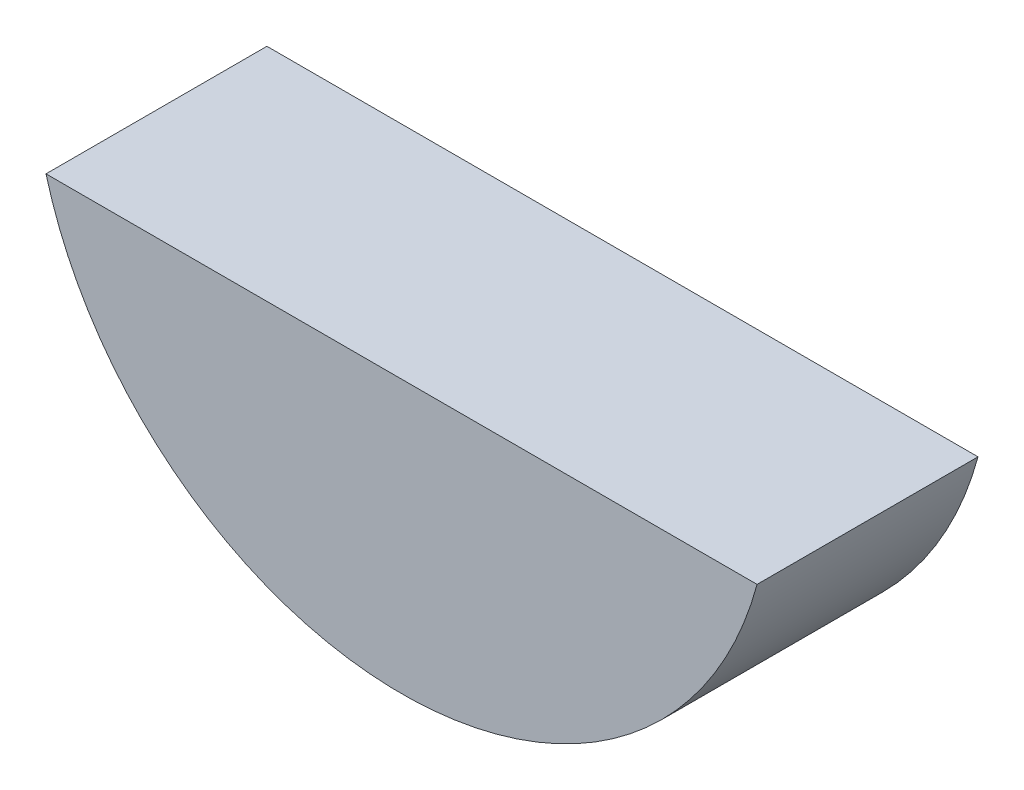
from build123d import *

# Parameters (mm, degrees)
VYSUNOUT1_DEPTH = 1.5


with BuildPart() as part:
    # Skica1 → Vysunout1 (new, symmetric)
    with BuildSketch(Plane.XY):
        with BuildLine():
            Line((-4.828043082, 0), (4.828043082, 0))
            ThreePointArc((4.828043082, 0), (0, -3.7), (-4.828043082, 0))
        make_face()
    extrude(amount=VYSUNOUT1_DEPTH, both=True)


solid = part.part
